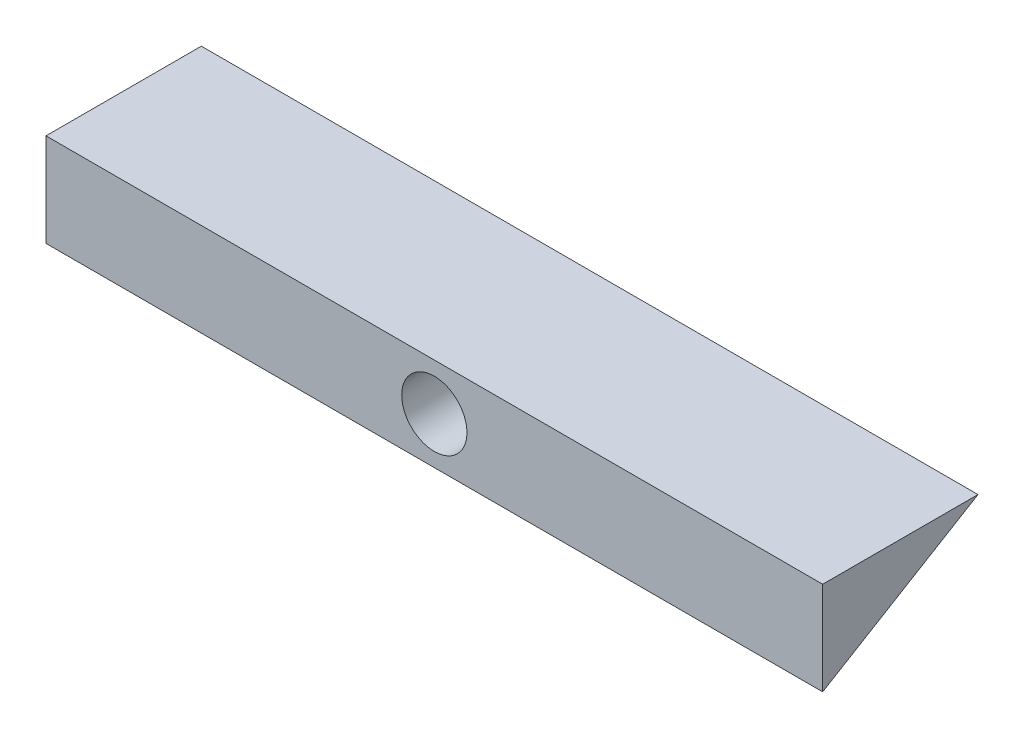
from build123d import *

# Parameters (mm, degrees)
BOSS_EXTRUDE1_DEPTH     = 25
SKETCH2_W               = 4
SKETCH2_H               = 3
BOSS_EXTRUDE2_DEPTH     = 5
CUT_EXTRUDE1_DEPTH      = 26.670995306
CUT_EXTRUDE1_DEPTH_BACK = 26.670995306
SKETCH3_R               = 1.05


with BuildPart() as part:
    # Sketch1 → Boss-Extrude1 (new body)
    with BuildSketch(Plane(origin=(0, 0, 0), x_dir=(0, 0, -1), z_dir=(1, 0, 0))):
        Polygon((0, 0), (-5, 0), (-5, -3), align=None)
    extrude(amount=BOSS_EXTRUDE1_DEPTH)

    # Sketch2 → Boss-Extrude2 (add)
    with BuildSketch(Plane.XY.offset(5)):
        with Locations((12.5, -1.5)):
            Rectangle(SKETCH2_W, SKETCH2_H)
    extrude(amount=-BOSS_EXTRUDE2_DEPTH)

    # Sketch3 → Cut-Extrude1 (cut, two sides: drawn at the far end of the back side and taken through both)
    with BuildSketch(Plane(origin=(0, 0, 0), x_dir=(-1, 0, 0), z_dir=(0, 0, -1)).offset(-CUT_EXTRUDE1_DEPTH_BACK)):
        with Locations((-12.5, -1.5)):
            Circle(SKETCH3_R)
    extrude(amount=CUT_EXTRUDE1_DEPTH + CUT_EXTRUDE1_DEPTH_BACK, mode=Mode.SUBTRACT)


solid = part.part
